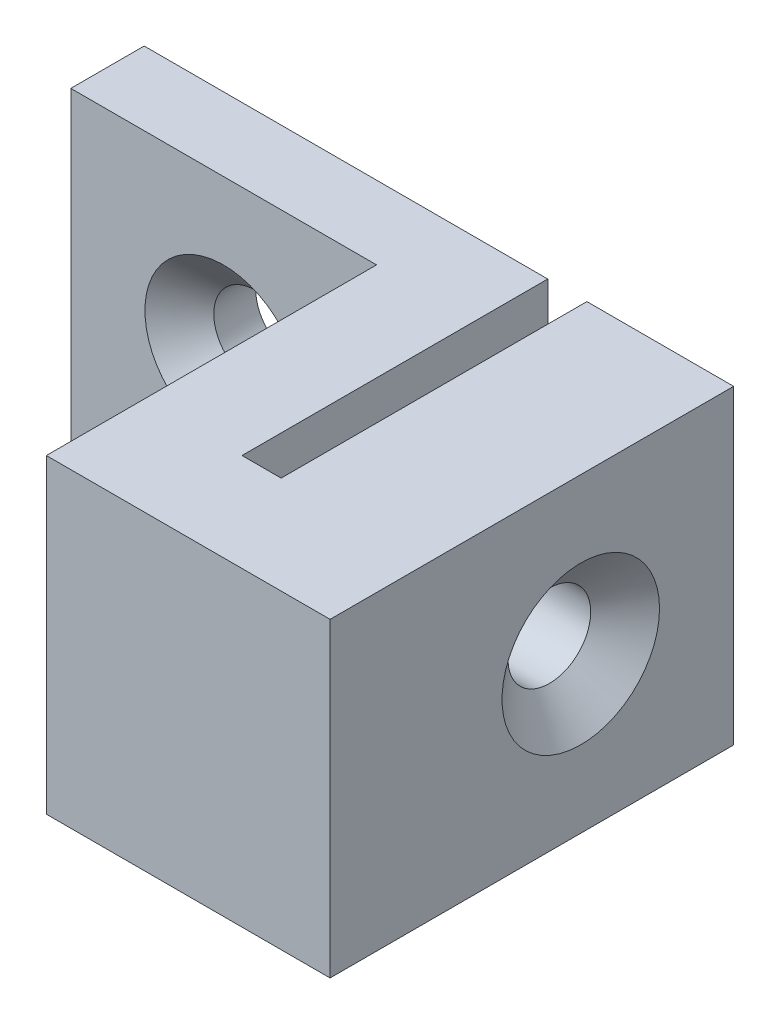
from build123d import *

# Parameters (mm, degrees)
BOSS_EXTRUDE1_DEPTH                                 = 25.4
CSK_FOR_1_4_FLAT_HEAD_MACHINE_SCREW_100_D           = 6.7564
CSK_FOR_1_4_FLAT_HEAD_MACHINE_SCREW_100_DEPTH       = 16.51
CSK_FOR_1_4_FLAT_HEAD_MACHINE_SCREW_100_CSINK_D     = 12.8778
CSK_FOR_1_4_FLAT_HEAD_MACHINE_SCREW_100_CSINK_ANGLE = 100
CSK_FOR_1_4_FLAT_HEAD_MACHINE_SCREW_100_TIP         = 2.029827343
CSK_FOR_1_4_FLAT_HEAD_MACHINE_SCREW_2_D             = 6.7564
CSK_FOR_1_4_FLAT_HEAD_MACHINE_SCREW_2_DEPTH         = 16.51
CSK_FOR_1_4_FLAT_HEAD_MACHINE_SCREW_2_CSINK_D       = 12.8778
CSK_FOR_1_4_FLAT_HEAD_MACHINE_SCREW_2_CSINK_ANGLE   = 100
CSK_FOR_1_4_FLAT_HEAD_MACHINE_SCREW_2_TIP           = 2.029827343


with BuildPart() as part:
    # Sketch1 → Boss-Extrude1 (new body)
    with BuildSketch(Plane(origin=(0, 0, 0), x_dir=(1, 0, 0), z_dir=(0, 1, 0))):
        Polygon((-1.6, 0), (1.6, 0), (1.6, 25), (13.6, 25), (13.6, -8), (-9.6, -8), (-9.6, 19), (-34.6, 19), (-34.6, 25), (-1.6, 25), align=None)
    extrude(amount=BOSS_EXTRUDE1_DEPTH)

    # Sketch3 → 1/4-20 Tapped Hole1 (revolve, cut)
    with BuildSketch(Plane(origin=(-1.6, 12.7, -12.5), x_dir=(0, 0, -1), z_dir=(0, 1, 0))):
        Polygon((0, 0), (0, 18.043816902), (2.5527, 16.51), (2.5527, 0), align=None)
    revolve(axis=Axis((4.75, 12.7, -12.5), (-1, 0, 0)), mode=Mode.SUBTRACT)

    # CSK for 1_4 Flat Head Machine Screw _100
    with Locations(Plane(origin=(13.6, 0, 0), x_dir=(0, 0, -1), z_dir=(1, 0, 0))):
        with Locations((12.5, 12.7)):
            CounterSinkHole(CSK_FOR_1_4_FLAT_HEAD_MACHINE_SCREW_100_D / 2, CSK_FOR_1_4_FLAT_HEAD_MACHINE_SCREW_100_CSINK_D / 2, depth=CSK_FOR_1_4_FLAT_HEAD_MACHINE_SCREW_100_DEPTH, counter_sink_angle=CSK_FOR_1_4_FLAT_HEAD_MACHINE_SCREW_100_CSINK_ANGLE)
            with Locations((0, 0, -(CSK_FOR_1_4_FLAT_HEAD_MACHINE_SCREW_100_DEPTH + CSK_FOR_1_4_FLAT_HEAD_MACHINE_SCREW_100_TIP / 2))):  # 118° drill point
                Cone(0, CSK_FOR_1_4_FLAT_HEAD_MACHINE_SCREW_100_D / 2, CSK_FOR_1_4_FLAT_HEAD_MACHINE_SCREW_100_TIP, mode=Mode.SUBTRACT)

    # CSK for 1_4 Flat Head Machine Screw  2
    with Locations(Plane.XY.offset(-19)):
        with Locations((-22.1, 12.7)):
            CounterSinkHole(CSK_FOR_1_4_FLAT_HEAD_MACHINE_SCREW_2_D / 2, CSK_FOR_1_4_FLAT_HEAD_MACHINE_SCREW_2_CSINK_D / 2, depth=CSK_FOR_1_4_FLAT_HEAD_MACHINE_SCREW_2_DEPTH, counter_sink_angle=CSK_FOR_1_4_FLAT_HEAD_MACHINE_SCREW_2_CSINK_ANGLE)
            with Locations((0, 0, -(CSK_FOR_1_4_FLAT_HEAD_MACHINE_SCREW_2_DEPTH + CSK_FOR_1_4_FLAT_HEAD_MACHINE_SCREW_2_TIP / 2))):  # 118° drill point
                Cone(0, CSK_FOR_1_4_FLAT_HEAD_MACHINE_SCREW_2_D / 2, CSK_FOR_1_4_FLAT_HEAD_MACHINE_SCREW_2_TIP, mode=Mode.SUBTRACT)


solid = part.part
